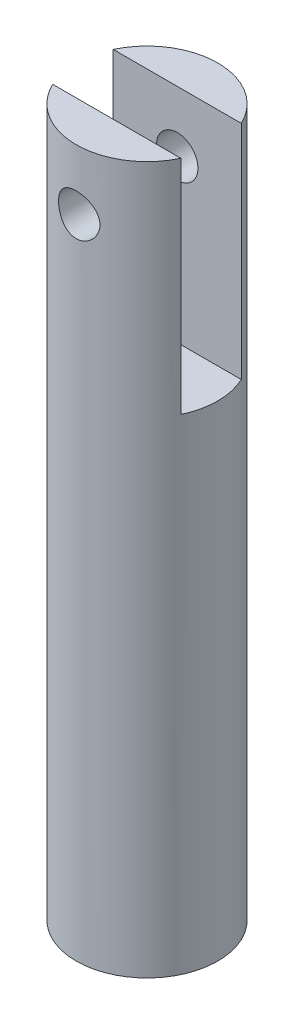
from build123d import *

# Parameters (mm, degrees)
SKETCH1_R               = 5.5626
BOSS_EXTRUDE1_DEPTH     = 55.5244
CUT_EXTRUDE1_DEPTH      = 57.078908984
CUT_EXTRUDE1_DEPTH_BACK = 57.078908984
SKETCH2_R               = 1.6256
CUT_EXTRUDE2_DEPTH      = 57.078909103
CUT_EXTRUDE2_DEPTH_BACK = 57.078909103
SKETCH3_W               = 4.7498
SKETCH3_H               = 17.4244


with BuildPart() as part:
    # Sketch1 → Boss-Extrude1 (new body)
    with BuildSketch(Plane(origin=(0, 0, 0), x_dir=(1, 0, 0), z_dir=(0, 1, 0))):
        with Locations(Location((0, 0, 0), (0, 0, 90))):
            Circle(SKETCH1_R)
    extrude(amount=BOSS_EXTRUDE1_DEPTH)

    # Sketch2 → Cut-Extrude1 (cut, two sides: drawn at the far end of the back side and taken through both)
    with BuildSketch(Plane.XY.offset(-CUT_EXTRUDE1_DEPTH_BACK)):
        with Locations(Location((0, 50.7619, 0), (0, 0, 89.999999974))):
            Circle(SKETCH2_R)
    extrude(amount=CUT_EXTRUDE1_DEPTH + CUT_EXTRUDE1_DEPTH_BACK, mode=Mode.SUBTRACT)

    # Sketch3 → Cut-Extrude2 (cut, two sides: drawn at the far end of the back side and taken through both)
    with BuildSketch(Plane(origin=(0, 0, 0), x_dir=(0, 0, -1), z_dir=(1, 0, 0)).offset(-CUT_EXTRUDE2_DEPTH_BACK)):
        with Locations((0, 46.8122)):
            Rectangle(SKETCH3_W, SKETCH3_H)
    extrude(amount=CUT_EXTRUDE2_DEPTH + CUT_EXTRUDE2_DEPTH_BACK, mode=Mode.SUBTRACT)


solid = part.part
